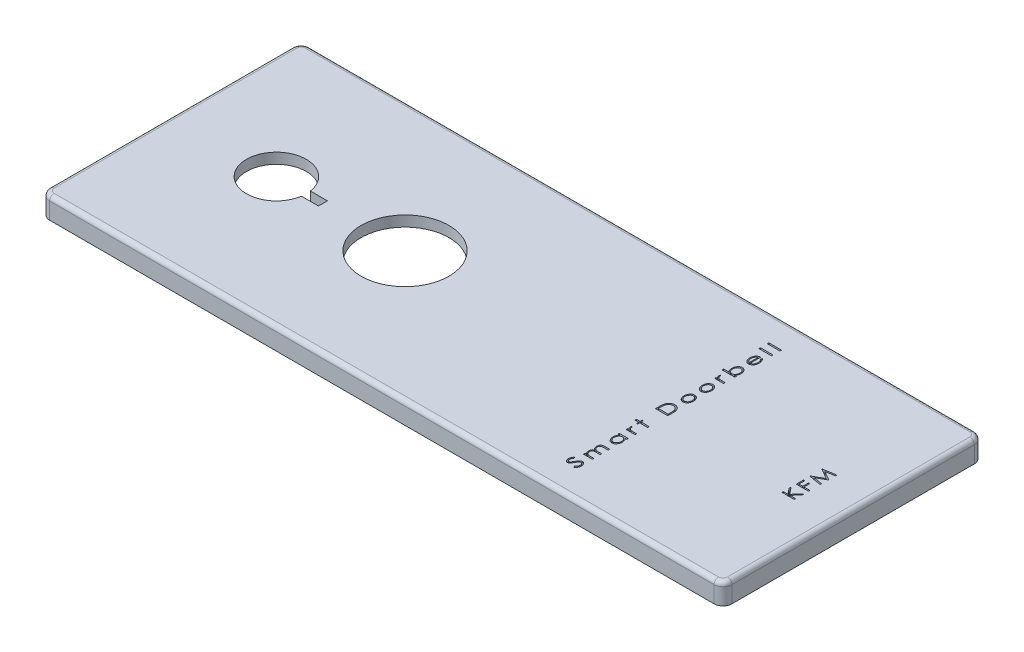
from build123d import *

# Parameters (mm, degrees)
SKETCH1_W           = 194
SKETCH1_H           = 74
BOSS_EXTRUDE1_DEPTH = 6
FILLET1_R           = 2.54
SKETCH7_W           = 192
SKETCH7_H           = 72
CUT_EXTRUDE3_DEPTH  = 3
FILLET2_R           = 2.54
FILLET3_R           = 1.27
SKETCH2_R           = 12.5
CUT_EXTRUDE4_DEPTH  = 8.385535023
SKETCH11_W          = 3.58974359
SKETCH11_H          = 0.448717949
CUT_EXTRUDE6_DEPTH  = 2.54


with BuildPart() as part:
    # Sketch1 → Boss-Extrude1 (new body)
    with BuildSketch(Plane(origin=(0, 0, 0), x_dir=(1, 0, 0), z_dir=(0, 1, 0))):
        Rectangle(SKETCH1_W, SKETCH1_H)
    extrude(amount=BOSS_EXTRUDE1_DEPTH)

    # Fillet1
    fillet1_edges = [part.edges().sort_by_distance(p)[0] for p in [
        (97, 3, 37),
        (-97, 3, 37),
        (-97, 3, -37),
        (97, 3, -37),
    ]]
    fillet(fillet1_edges, radius=FILLET1_R)

    # Sketch7 → Cut-Extrude3 (cut)
    with BuildSketch(Plane.XZ):
        Rectangle(SKETCH7_W, SKETCH7_H)
    extrude(amount=-CUT_EXTRUDE3_DEPTH, mode=Mode.SUBTRACT)

    # Fillet2
    fillet2_edges = [part.edges().sort_by_distance(p)[0] for p in [
        (96, 1.5, 36),
        (96, 1.5, -36),
        (-96, 1.5, -36),
        (-96, 1.5, 36),
    ]]
    fillet(fillet2_edges, radius=FILLET2_R)

    # Fillet3
    fillet3_edges = [part.edges().sort_by_distance(p)[0] for p in [
        (-97, 6, 0),
        (0, 6, -37),
        (97, 6, 0),
        (0, 6, 37),
        (-96.256051224, 6, 36.256051224),
        (96.256051224, 6, 36.256051224),
        (96.256051224, 6, -36.256051224),
        (-96.256051224, 6, -36.256051224),
    ]]
    fillet(fillet3_edges, radius=FILLET3_R)

    # Sketch2 → Cut-Extrude4 (cut)
    with BuildSketch(Plane(origin=(0, 6, 0), x_dir=(1, 0, 0), z_dir=(0, 1, 0))):
        with BuildLine():
            Line((-63.23174039, 1.276717301), (-63.23174039, -1.276717301))
            Line((-63.23174039, -1.276717301), (-58.596429751, -1.276717301))
            ThreePointArc((-58.596429751, -1.276717301), (-58.524141721, -0.640176883), (-58.5, 0))
            ThreePointArc((-58.5, 0), (-58.524141721, 0.640176883), (-58.596429751, 1.276717301))
            Line((-58.596429751, 1.276717301), (-63.23174039, 1.276717301))
        make_face()
        with BuildLine():
            Line((-58.596429751, -1.276717301), (-63.23174039, -1.276717301))
            Line((-63.23174039, -1.276717301), (-63.23174039, 1.276717301))
            Line((-63.23174039, 1.276717301), (-58.596429751, 1.276717301))
            ThreePointArc((-58.596429751, 1.276717301), (-75.5, 0), (-58.596429751, -1.276717301))
        make_face()
        with BuildLine():
            Line((-63.23174039, 1.276717301), (-63.23174039, -1.276717301))
            Line((-63.23174039, -1.276717301), (-58.596429751, -1.276717301))
            ThreePointArc((-58.596429751, -1.276717301), (-58.524141721, -0.640176883), (-58.5, 0))
            ThreePointArc((-58.5, 0), (-58.524141721, 0.640176883), (-58.596429751, 1.276717301))
            Line((-58.596429751, 1.276717301), (-63.23174039, 1.276717301))
        make_face()
        with BuildLine():
            Line((-58.596429751, -1.276717301), (-63.23174039, -1.276717301))
            Line((-63.23174039, -1.276717301), (-63.23174039, 1.276717301))
            Line((-63.23174039, 1.276717301), (-58.596429751, 1.276717301))
            ThreePointArc((-58.596429751, 1.276717301), (-75.5, 0), (-58.596429751, -1.276717301))
        make_face()
        with BuildLine():
            ThreePointArc((-58.5, 0), (-58.524141721, -0.640176883), (-58.596429751, -1.276717301))
            Line((-58.596429751, -1.276717301), (-53.76825961, -1.276717301))
            Line((-53.76825961, -1.276717301), (-53.76825961, 1.276717301))
            Line((-53.76825961, 1.276717301), (-58.596429751, 1.276717301))
            ThreePointArc((-58.596429751, 1.276717301), (-58.524141721, 0.640176883), (-58.5, 0))
        make_face()
        with Locations(Location((-30.415448, 0, 0), (0, 0, 270))):
            Circle(SKETCH2_R)
    extrude(amount=-CUT_EXTRUDE4_DEPTH, mode=Mode.SUBTRACT)

    # Sketch11 → Cut-Extrude6 (cut)
    # profile 1 of 16: a face of its own
    with BuildSketch(Plane(origin=(0, 6, 0), x_dir=(1, 0, 0), z_dir=(0, 1, 0))):
        with BuildLine():
            Line((46.889039679, -29.292307692), (46.711655865, -28.913701923))
            add(Edge.make_bspline(
                [(46.711655865, -28.913701923), (46.757970731, -28.879314746), (46.847732027, -28.812670104), (46.965932258, -28.701127868), (47.068029234, -28.587351678), (47.15041218, -28.468277492), (47.215601179, -28.345173689), (47.261005469, -28.217636264), (47.289947535, -28.086036475), (47.293298766, -27.996783778), (47.294989199, -27.951762821)],
                knots=[0, 0, 0, 0, 1.18159898, 2.29001761, 3.325282218, 4.310061346, 5.250817561, 6.172208976, 7.078023342, 8, 8, 8, 8], degree=3))
            add(Edge.make_bspline(
                [(47.294989199, -27.951762821), (47.294111768, -27.913384171), (47.292376334, -27.837476636), (47.27658171, -27.725648815), (47.250309192, -27.617547817), (47.215046428, -27.514200748), (47.171809079, -27.418209656), (47.12046078, -27.332844687), (47.061464308, -27.260079085), (46.995955857, -27.200210715), (46.926382167, -27.152675982), (46.853791277, -27.118544194), (46.778449705, -27.097893175), (46.727438144, -27.095027674), (46.70184016, -27.093589744)],
                knots=[0, 0, 0, 0, 1.199683564, 2.372804237, 3.523235669, 4.674224121, 5.782924596, 6.8094747, 7.780844139, 8.701655783, 9.575318352, 10.405821323, 11.200029174, 12, 12, 12, 12], degree=3))
            add(Edge.make_bspline(
                [(46.70184016, -27.093589744), (46.672617119, -27.095540588), (46.612956744, -27.099523338), (46.52496876, -27.131383383), (46.438263841, -27.182036183), (46.385840127, -27.227926858), (46.358290481, -27.252043269)],
                knots=[0, 0, 0, 0, 0.903840048, 1.845236969, 2.867631571, 4, 4, 4, 4], degree=3))
            add(Edge.make_bspline(
                [(46.358290481, -27.252043269), (46.33815545, -27.271886963), (46.295478766, -27.31394615), (46.233553917, -27.386115835), (46.168076862, -27.468997701), (46.100793949, -27.563966667), (46.028727319, -27.669125865), (45.955115224, -27.786260286), (45.877456191, -27.914051953), (45.826590309, -28.003966855), (45.800197532, -28.050620994)],
                knots=[0, 0, 0, 0, 0.693950147, 1.470844071, 2.333096396, 3.28712547, 4.328157476, 5.463343168, 6.68380505, 8, 8, 8, 8], degree=3))
            add(Edge.make_bspline(
                [(45.800197532, -28.050620994), (45.774005857, -28.097021487), (45.724012687, -28.185588092), (45.649230549, -28.31008941), (45.581707667, -28.421789649), (45.519209941, -28.519459037), (45.462619755, -28.603373611), (45.412464817, -28.674145996), (45.367136991, -28.730499324), (45.337388188, -28.762172456), (45.324135833, -28.776282051)],
                knots=[0, 0, 0, 0, 1.470410718, 2.806635812, 4.007937028, 5.072494864, 6.006298942, 6.801071501, 7.465907055, 8, 8, 8, 8], degree=3))
            add(Edge.make_bspline(
                [(45.324135833, -28.776282051), (45.303587665, -28.795721034), (45.263469406, -28.833673719), (45.200483636, -28.884662995), (45.135300598, -28.926730029), (45.069572852, -28.962489667), (45.001532577, -28.988875971), (44.932713801, -29.009116509), (44.862221406, -29.020247223), (44.814922006, -29.022133981), (44.791283269, -29.023076923)],
                knots=[0, 0, 0, 0, 1.125475438, 2.197379131, 3.218875901, 4.209072094, 5.1692903, 6.117178908, 7.059025867, 8, 8, 8, 8], degree=3))
            add(Edge.make_bspline(
                [(44.791283269, -29.023076923), (44.754183422, -29.021360854), (44.680360582, -29.017946148), (44.572761794, -28.989275862), (44.470195417, -28.943798752), (44.373879345, -28.880199304), (44.285890449, -28.799570054), (44.205537307, -28.704949164), (44.137321123, -28.594294054), (44.078726717, -28.471372551), (44.032394151, -28.338210916), (43.998418746, -28.197852505), (43.97878908, -28.051644276), (43.97592597, -27.952287499), (43.974476378, -27.901983173)],
                knots=[0, 0, 0, 0, 0.867240601, 1.725671923, 2.587703721, 3.484395499, 4.41390936, 5.372787421, 6.380585102, 7.447407238, 8.554669295, 9.67449481, 10.822596967, 12, 12, 12, 12], degree=3))
            add(Edge.make_bspline(
                [(43.974476378, -27.901983173), (43.97566231, -27.848378559), (43.9780087, -27.7423208), (44.001577703, -27.586255352), (44.03768375, -27.435379407), (44.080656444, -27.313760635), (44.123634252, -27.218212294), (44.162181835, -27.145322126), (44.207588313, -27.071810799), (44.257588048, -26.996632656), (44.315320993, -26.921481054), (44.378011171, -26.844402769), (44.447507214, -26.766734322), (44.496870138, -26.715752055), (44.5220525, -26.68974359)],
                knots=[0, 0, 0, 0, 1.407881899, 2.785521393, 4.13817915, 5.480548258, 6.167805339, 6.890410056, 7.645688891, 8.437829636, 9.262108027, 10.135064808, 11.048608351, 12, 12, 12, 12], degree=3))
            Line((44.5220525, -26.68974359), (44.737296891, -27.052924679))
            add(Edge.make_bspline(
                [(44.737296891, -27.052924679), (44.717589359, -27.074823923), (44.679365436, -27.117298799), (44.625031755, -27.180199476), (44.576941819, -27.241424543), (44.532945058, -27.29935906), (44.495389859, -27.355655164), (44.461866313, -27.408777411), (44.434708125, -27.460076347), (44.404403105, -27.524705147), (44.376034259, -27.606560301), (44.351189294, -27.707689446), (44.336182451, -27.813192245), (44.334370525, -27.885108006), (44.333450737, -27.921614583)],
                knots=[0, 0, 0, 0, 1.076597331, 2.088124094, 3.036423676, 3.921181853, 4.745469441, 5.508604631, 6.215425407, 6.864980066, 8.115604893, 9.372889374, 10.666400572, 12, 12, 12, 12], degree=3))
            add(Edge.make_bspline(
                [(44.333450737, -27.921614583), (44.334627058, -27.967559044), (44.336884536, -28.055731103), (44.362409156, -28.180935213), (44.400954829, -28.294015599), (44.448428073, -28.376898296), (44.492725451, -28.434633623), (44.527576513, -28.471963889), (44.564723667, -28.503158019), (44.603063658, -28.52968767), (44.644323141, -28.548949552), (44.686595406, -28.564352852), (44.7311266, -28.572704884), (44.761338186, -28.573804802), (44.776559712, -28.574358974)],
                knots=[0, 0, 0, 0, 1.888920497, 3.625029172, 5.238005106, 6.78953948, 7.530511953, 8.231613766, 8.887054938, 9.524884661, 10.144602648, 10.756275426, 11.373373346, 12, 12, 12, 12], degree=3))
            add(Edge.make_bspline(
                [(44.776559712, -28.574358974), (44.795296698, -28.573397356), (44.83308822, -28.571457823), (44.88927289, -28.560435771), (44.944078664, -28.539826239), (44.999212702, -28.51228669), (45.055029191, -28.473277817), (45.111224907, -28.421289813), (45.170706898, -28.357681676), (45.20860942, -28.309198759), (45.228783269, -28.283393429)],
                knots=[0, 0, 0, 0, 0.80510108, 1.62384681, 2.446090813, 3.312295497, 4.264354022, 5.358646259, 6.59412333, 8, 8, 8, 8], degree=3))
            add(Edge.make_bspline(
                [(45.228783269, -28.283393429), (45.235637563, -28.273629045), (45.252029616, -28.250277505), (45.278351009, -28.207966507), (45.31129233, -28.15275975), (45.352163817, -28.085143969), (45.398567421, -28.003943016), (45.452214885, -27.910300593), (45.51245845, -27.803698198), (45.55482909, -27.728118487), (45.577240801, -27.688141026)],
                knots=[0, 0, 0, 0, 0.414939005, 0.992327248, 1.732675797, 2.651488209, 3.740549015, 4.985896868, 6.40570715, 8, 8, 8, 8], degree=3))
            add(Edge.make_bspline(
                [(45.577240801, -27.688141026), (45.604821727, -27.640095454), (45.658045979, -27.547379581), (45.738879109, -27.415255061), (45.817029782, -27.294563504), (45.893452378, -27.185945085), (45.966899508, -27.088751612), (46.038252597, -27.003536638), (46.107839007, -26.930543721), (46.174743084, -26.867556088), (46.241934337, -26.815494031), (46.307371506, -26.769342984), (46.374040732, -26.731413885), (46.440120726, -26.699570199), (46.506959953, -26.6755952), (46.573294083, -26.658011866), (46.64000213, -26.646876874), (46.68450389, -26.645540019), (46.706748013, -26.644871795)],
                knots=[0, 0, 0, 0, 1.654080378, 3.191959259, 4.624239409, 5.946527435, 7.156573893, 8.260914573, 9.262885886, 10.166527317, 11.001347069, 11.798847207, 12.555328937, 13.288868751, 13.986408186, 14.671906212, 15.336154766, 16, 16, 16, 16], degree=3))
            add(Edge.make_bspline(
                [(46.706748013, -26.644871795), (46.738144783, -26.645888033), (46.800504095, -26.647906455), (46.892290599, -26.666018339), (46.980669992, -26.695945383), (47.066169556, -26.736721118), (47.148038171, -26.790165807), (47.226616103, -26.855005996), (47.301972243, -26.931563721), (47.373346234, -27.018337284), (47.438640282, -27.11368293), (47.496251538, -27.215019409), (47.5458205, -27.320968189), (47.584917987, -27.432703334), (47.615721849, -27.549239885), (47.638157195, -27.67084583), (47.651792144, -27.79743614), (47.653231805, -27.883486046), (47.653963558, -27.927223558)],
                knots=[0, 0, 0, 0, 0.855215978, 1.698603995, 2.538713148, 3.393573107, 4.273606149, 5.197008056, 6.165568152, 7.197451656, 8.255955132, 9.311674963, 10.372017383, 11.439968988, 12.534052632, 13.654908543, 14.808035136, 16, 16, 16, 16], degree=3))
            add(Edge.make_bspline(
                [(47.653963558, -27.927223558), (47.653455635, -27.961131909), (47.652448716, -28.028352747), (47.643482538, -28.12777304), (47.630767475, -28.225090545), (47.61055056, -28.319720443), (47.586442352, -28.41237586), (47.555998197, -28.502471597), (47.52036061, -28.590135599), (47.478746724, -28.675436725), (47.43089524, -28.758870561), (47.375140593, -28.840092922), (47.312766709, -28.920060999), (47.242913278, -28.998467346), (47.164851717, -29.07444688), (47.080081883, -29.149519312), (46.9878755, -29.22279798), (46.922467644, -29.268798319), (46.889039679, -29.292307692)],
                knots=[0, 0, 0, 0, 0.993936135, 1.970406054, 2.924919642, 3.869643596, 4.80537901, 5.73061892, 6.655681204, 7.578100447, 8.511298525, 9.472966899, 10.463969947, 11.483118484, 12.549103058, 13.65588568, 14.801994522, 16, 16, 16, 16], degree=3))
        make_face()
    # profile 2 of 16: a face of its own
    with BuildSketch(Plane(origin=(0, 6, 0), x_dir=(1, 0, 0), z_dir=(0, 1, 0))):
        with BuildLine():
            Line((45.00652766, -24.706410256), (45.00652766, -24.257692308))
            Line((45.00652766, -24.257692308), (45.451038878, -24.257692308))
            add(Edge.make_bspline(
                [(45.451038878, -24.257692308), (45.41205999, -24.221174176), (45.336801783, -24.150667059), (45.237985432, -24.037750196), (45.155446463, -23.923587715), (45.112297715, -23.843583146), (45.091363397, -23.804767628)],
                knots=[0, 0, 0, 0, 1.101334499, 2.126393606, 3.090989394, 4, 4, 4, 4], degree=3))
            add(Edge.make_bspline(
                [(45.091363397, -23.804767628), (45.071300416, -23.751140539), (45.03116006, -23.643847892), (44.991326107, -23.476325512), (44.96671732, -23.304903744), (44.963351911, -23.189266583), (44.961655865, -23.130989583)],
                knots=[0, 0, 0, 0, 0.994664579, 1.990042673, 2.987053289, 4, 4, 4, 4], degree=3))
            add(Edge.make_bspline(
                [(44.961655865, -23.130989583), (44.962714803, -23.091694715), (44.964813478, -23.013817475), (44.978047234, -22.898552483), (45.001484482, -22.786521975), (45.033406018, -22.678644479), (45.073042258, -22.577200018), (45.118327253, -22.483882161), (45.170444358, -22.400802396), (45.228919718, -22.325808429), (45.297877737, -22.258159538), (45.380144957, -22.198069024), (45.47389712, -22.140136128), (45.543185877, -22.108458192), (45.579344167, -22.091927083)],
                knots=[0, 0, 0, 0, 1.097831083, 2.17575623, 3.235997344, 4.291624794, 5.314936543, 6.275593864, 7.184984423, 8.049682257, 8.926909759, 9.873621098, 10.890350652, 12, 12, 12, 12], degree=3))
            add(Edge.make_bspline(
                [(45.579344167, -22.091927083), (45.554577858, -22.073993699), (45.505617117, -22.038541026), (45.43664701, -21.980562005), (45.37220791, -21.919750176), (45.31225089, -21.855590949), (45.256799754, -21.788121389), (45.205427317, -21.717373731), (45.159313647, -21.642960962), (45.1177108, -21.56574553), (45.081795678, -21.485784824), (45.048954668, -21.404702232), (45.022850891, -21.321489091), (44.999652374, -21.237281548), (44.983625031, -21.151101128), (44.970281475, -21.06373315), (44.963664153, -20.974673999), (44.962328192, -20.914751552), (44.961655865, -20.884595353)],
                knots=[0, 0, 0, 0, 1.039298392, 2.054598512, 3.060685051, 4.050098551, 5.037947508, 6.028126413, 7.020279882, 8.012083312, 9.00766699, 9.999183933, 10.984184812, 11.970978698, 12.966720897, 13.962304575, 14.97452203, 16, 16, 16, 16], degree=3))
            add(Edge.make_bspline(
                [(44.961655865, -20.884595353), (44.963271226, -20.829585699), (44.966429427, -20.722036058), (44.99104618, -20.565878318), (45.032687608, -20.419659105), (45.081226263, -20.305926292), (45.128253563, -20.221601901), (45.166045065, -20.162306513), (45.207552967, -20.107461692), (45.252501752, -20.056752067), (45.301014063, -20.010576849), (45.352353979, -19.968082446), (45.40720067, -19.930433676), (45.465400745, -19.895907964), (45.529575888, -19.866328306), (45.600555894, -19.840313145), (45.679273496, -19.819111898), (45.764879967, -19.800753518), (45.857849997, -19.786918346), (45.958241487, -19.777249468), (46.066096397, -19.771827521), (46.140469357, -19.770959977), (46.178803301, -19.770512821)],
                knots=[0, 0, 0, 0, 1.740115549, 3.40210833, 4.986751564, 6.540393993, 7.301767359, 8.040242504, 8.763490493, 9.475882005, 10.181989344, 10.880778504, 11.582340415, 12.284992797, 13.019458093, 13.814905421, 14.674298876, 15.596763126, 16.584059029, 17.646615918, 18.786998757, 20, 20, 20, 20], degree=3))
            Line((46.178803301, -19.770512821), (47.564219968, -19.770512821))
            Line((47.564219968, -19.770512821), (47.564219968, -20.219230769))
            Line((47.564219968, -20.219230769), (46.177401058, -20.219230769))
            add(Edge.make_bspline(
                [(46.177401058, -20.219230769), (46.144678763, -20.219532791), (46.081785649, -20.220113285), (45.991537147, -20.223578494), (45.909224781, -20.229112937), (45.834796446, -20.236562592), (45.768197947, -20.246632934), (45.709888166, -20.260412607), (45.659016615, -20.274207088), (45.602700644, -20.298012675), (45.539973478, -20.335166087), (45.474389353, -20.393806498), (45.416362691, -20.465225267), (45.366263993, -20.548470847), (45.325621211, -20.642759172), (45.296384379, -20.746439995), (45.278521833, -20.858970783), (45.276700039, -20.936876954), (45.275758429, -20.977143429)],
                knots=[0, 0, 0, 0, 1.143098113, 2.197064715, 3.154501, 4.02454852, 4.809751659, 5.504904279, 6.117215791, 6.647885767, 7.636389118, 8.648645385, 9.70444437, 10.839966305, 12.032044546, 13.280199171, 14.594247509, 16, 16, 16, 16], degree=3))
            add(Edge.make_bspline(
                [(45.275758429, -20.977143429), (45.277586792, -21.026561804), (45.281191282, -21.123986731), (45.307529599, -21.267031109), (45.352409397, -21.403139209), (45.402667386, -21.51090796), (45.451729317, -21.591207025), (45.490372745, -21.648378524), (45.533927584, -21.699915237), (45.578224796, -21.749059523), (45.6273629, -21.792228658), (45.678085205, -21.832628513), (45.732782712, -21.867441094), (45.790261221, -21.900051866), (45.854744823, -21.927943292), (45.928316579, -21.950329758), (46.011259395, -21.971071571), (46.104174925, -21.986380598), (46.206610871, -21.999081842), (46.318651148, -22.008141197), (46.440752655, -22.012604891), (46.525388176, -22.013590742), (46.569328141, -22.014102564)],
                knots=[0, 0, 0, 0, 1.557483399, 3.070471446, 4.566230727, 6.065741215, 6.806162569, 7.531661784, 8.238209249, 8.931573699, 9.615003145, 10.297359546, 10.973763715, 11.656438231, 12.379088812, 13.182953495, 14.078184211, 15.072601343, 16.149083951, 17.331763349, 18.614739708, 20, 20, 20, 20], degree=3))
            Line((46.569328141, -22.014102564), (47.564219968, -22.014102564))
            Line((47.564219968, -22.014102564), (47.564219968, -22.462820513))
            Line((47.564219968, -22.462820513), (46.263639038, -22.462820513))
            add(Edge.make_bspline(
                [(46.263639038, -22.462820513), (46.226949153, -22.463243987), (46.156363562, -22.464058684), (46.05506012, -22.465927513), (45.963033431, -22.473026636), (45.880105048, -22.479840594), (45.80679052, -22.490836043), (45.742070595, -22.501867711), (45.68716116, -22.517427402), (45.625620219, -22.539467787), (45.558884996, -22.577296146), (45.487422726, -22.634799047), (45.425603868, -22.707133066), (45.371670627, -22.791162959), (45.328545194, -22.886337297), (45.297441193, -22.991014661), (45.279357928, -23.104185708), (45.276979891, -23.182573311), (45.275758429, -23.222836538)],
                knots=[0, 0, 0, 0, 1.211694182, 2.3311097, 3.344442162, 4.25901649, 5.077546103, 5.791957782, 6.424812874, 6.95952987, 7.947448357, 8.940567637, 9.97435178, 11.074664523, 12.228117035, 13.412269116, 14.670830671, 16, 16, 16, 16], degree=3))
            add(Edge.make_bspline(
                [(45.275758429, -23.222836538), (45.27728506, -23.270402137), (45.280316477, -23.364852703), (45.307431564, -23.503805076), (45.350302394, -23.638048525), (45.409600736, -23.765518872), (45.482783787, -23.882820054), (45.56990753, -23.984990497), (45.668503455, -24.07095095), (45.760687848, -24.129649757), (45.842988459, -24.166847916), (45.91272729, -24.191148053), (45.989985024, -24.212260635), (46.074907481, -24.228528302), (46.167270471, -24.242153407), (46.267250473, -24.250678576), (46.375049215, -24.256478389), (46.449427689, -24.257277773), (46.487998013, -24.257692308)],
                knots=[0, 0, 0, 0, 1.253865983, 2.489789985, 3.72021086, 4.964351554, 6.189182499, 7.356887196, 8.493190418, 9.629125542, 10.225149921, 10.872600471, 11.575623069, 12.336233242, 13.152419818, 14.037781816, 14.9824557, 16, 16, 16, 16], degree=3))
            Line((46.487998013, -24.257692308), (47.564219968, -24.257692308))
            Line((47.564219968, -24.257692308), (47.564219968, -24.706410256))
            Line((47.564219968, -24.706410256), (45.00652766, -24.706410256))
        make_face()
    # profile 3 of 16: a face of its own
    with BuildSketch(Plane(origin=(0, 6, 0), x_dir=(1, 0, 0), z_dir=(0, 1, 0))):
        with BuildLine():
            Line((45.00652766, -14.466666667), (47.564219968, -14.466666667))
            Line((47.564219968, -14.466666667), (47.564219968, -14.915384615))
            Line((47.564219968, -14.915384615), (47.121812115, -14.915384615))
            add(Edge.make_bspline(
                [(47.121812115, -14.915384615), (47.162021673, -14.960177081), (47.241713462, -15.04895179), (47.343735067, -15.194791613), (47.427299609, -15.349535615), (47.495083458, -15.511574453), (47.546254598, -15.681830134), (47.582074756, -15.859544226), (47.605682666, -16.044960149), (47.607941122, -16.171253069), (47.609091763, -16.235596955)],
                knots=[0, 0, 0, 0, 1.000141611, 1.982192266, 2.950680942, 3.919122848, 4.897600045, 5.90123798, 6.930719926, 8, 8, 8, 8], degree=3))
            add(Edge.make_bspline(
                [(47.609091763, -16.235596955), (47.607858359, -16.292670093), (47.605425588, -16.405241369), (47.586827033, -16.570749663), (47.55676804, -16.729943231), (47.514843704, -16.882808382), (47.459831798, -17.029085155), (47.393014278, -17.1691412), (47.314229204, -17.303060884), (47.223822684, -17.428600574), (47.125313576, -17.543583659), (47.020521197, -17.644837118), (46.909904367, -17.730436825), (46.793641828, -17.80031206), (46.672212629, -17.854874519), (46.545535146, -17.893606434), (46.413646322, -17.917492123), (46.323801876, -17.920349659), (46.278362596, -17.921794872)],
                knots=[0, 0, 0, 0, 1.149825968, 2.267921147, 3.351292848, 4.411532189, 5.457652975, 6.496092779, 7.534724766, 8.584157928, 9.609304174, 10.581842155, 11.515285724, 12.421436469, 13.308880013, 14.190720771, 15.08494796, 16, 16, 16, 16], degree=3))
            add(Edge.make_bspline(
                [(46.278362596, -17.921794872), (46.233863269, -17.920319306), (46.145655458, -17.917394399), (46.015930386, -17.893807049), (45.891299794, -17.853915033), (45.771552129, -17.799076704), (45.657136394, -17.728089057), (45.548043489, -17.641533934), (45.443038982, -17.540276433), (45.345778514, -17.423647431), (45.255579452, -17.297177142), (45.17727752, -17.162219216), (45.109953239, -17.021545824), (45.056175301, -16.873900966), (45.013161188, -16.720468354), (44.983049646, -16.560259249), (44.965548462, -16.393975534), (44.962965596, -16.28097745), (44.961655865, -16.223677885)],
                knots=[0, 0, 0, 0, 0.897261844, 1.778577538, 2.649325713, 3.531133061, 4.428679736, 5.358639195, 6.335549813, 7.365975323, 8.417697389, 9.465640286, 10.50951357, 11.559596491, 12.631383867, 13.72061521, 14.844159534, 16, 16, 16, 16], degree=3))
            add(Edge.make_bspline(
                [(44.961655865, -16.223677885), (44.963094824, -16.157708794), (44.965910584, -16.028620178), (44.989177679, -15.839807244), (45.028936079, -15.66097459), (45.073266738, -15.518356755), (45.118710614, -15.41013052), (45.156450897, -15.331642254), (45.198496007, -15.255580232), (45.245821824, -15.182451356), (45.297565136, -15.111747214), (45.354068746, -15.043697656), (45.414048788, -14.977297129), (45.45775864, -14.936129681), (45.479784872, -14.915384615)],
                knots=[0, 0, 0, 0, 1.63656381, 3.202435487, 4.710757276, 6.177917683, 6.900563395, 7.621601854, 8.338055115, 9.055469948, 9.781551101, 10.510682641, 11.249504442, 12, 12, 12, 12], degree=3))
            Line((45.479784872, -14.915384615), (45.00652766, -14.915384615))
            Line((45.00652766, -14.915384615), (45.00652766, -14.466666667))
        make_face()
        with BuildLine():
            add(Edge.make_bspline(
                [(45.275758429, -16.192828526), (45.277391697, -16.249472651), (45.280613181, -16.361198497), (45.305691306, -16.525569961), (45.347183702, -16.683212486), (45.404108777, -16.833101632), (45.476928722, -16.971522274), (45.562633101, -17.0973568), (45.66318969, -17.207172872), (45.756720626, -17.286860126), (45.836811145, -17.340693524), (45.897672643, -17.376103511), (45.959191686, -17.406745383), (46.022458725, -17.430063353), (46.08607522, -17.449349006), (46.150449475, -17.463666113), (46.216013813, -17.471232304), (46.259882719, -17.472461097), (46.281868205, -17.473076923)],
                knots=[0, 0, 0, 0, 1.507968544, 2.974343044, 4.415983075, 5.842267035, 7.234190907, 8.572097274, 9.88497308, 11.187853633, 11.833433198, 12.452551272, 13.06211745, 13.660880941, 14.245670215, 14.831617455, 15.414449519, 16, 16, 16, 16], degree=3))
            add(Edge.make_bspline(
                [(46.281868205, -17.473076923), (46.303631267, -17.472542557), (46.347317544, -17.471469892), (46.412225927, -17.462614173), (46.476742652, -17.449336324), (46.540360731, -17.43047859), (46.603146782, -17.405684065), (46.66513931, -17.375216055), (46.726501559, -17.339588688), (46.807401508, -17.285131996), (46.901956403, -17.205115675), (47.003819061, -17.094556476), (47.091178065, -16.968276721), (47.164100014, -16.828884232), (47.223066977, -16.67974563), (47.263955086, -16.522896344), (47.290331651, -16.36105445), (47.2934268, -16.251124508), (47.294989199, -16.195633013)],
                knots=[0, 0, 0, 0, 0.579533339, 1.163331439, 1.742095122, 2.333053014, 2.92845426, 3.538231715, 4.171458662, 4.817261987, 6.134129643, 7.460455727, 8.811035068, 10.2118506, 11.643131428, 13.073233751, 14.522598713, 16, 16, 16, 16], degree=3))
            add(Edge.make_bspline(
                [(47.294989199, -16.195633013), (47.293331597, -16.139458262), (47.290048716, -16.02820414), (47.264992492, -15.863555758), (47.222561784, -15.703695751), (47.17387069, -15.57505816), (47.128774881, -15.475949768), (47.090318994, -15.40635105), (47.050111442, -15.340485337), (47.006578066, -15.279296638), (46.960008652, -15.223001866), (46.910864791, -15.170695864), (46.858140302, -15.123137654), (46.802945266, -15.079660288), (46.745281674, -15.040997821), (46.685846115, -15.007265996), (46.624330966, -14.97904137), (46.561218088, -14.956032706), (46.496415668, -14.937383628), (46.429471777, -14.925090644), (46.36081958, -14.917109726), (46.314375829, -14.915962471), (46.290982788, -14.915384615)],
                knots=[0, 0, 0, 0, 1.862929283, 3.689532413, 5.509790606, 7.339943861, 8.245264366, 9.119513625, 9.975807529, 10.80402206, 11.608044803, 12.39773713, 13.182581747, 13.961121671, 14.726582501, 15.483357194, 16.225699007, 16.968850001, 17.710016933, 18.459609924, 19.224127972, 20, 20, 20, 20], degree=3))
            add(Edge.make_bspline(
                [(46.290982788, -14.915384615), (46.255612297, -14.916357025), (46.185823899, -14.918275655), (46.083536795, -14.936695239), (45.985378725, -14.965028262), (45.892138127, -15.006423394), (45.803296494, -15.058718242), (45.718578515, -15.122132338), (45.639080089, -15.198057687), (45.56504069, -15.284289883), (45.497361901, -15.378664136), (45.437299784, -15.478948897), (45.38761263, -15.58532655), (45.347093048, -15.696641608), (45.314087211, -15.812943436), (45.292641087, -15.935137051), (45.27765, -16.062281412), (45.276395722, -16.148845616), (45.275758429, -16.192828526)],
                knots=[0, 0, 0, 0, 0.934434866, 1.843703859, 2.739261944, 3.630245698, 4.533235222, 5.460181769, 6.421866164, 7.43398917, 8.461260833, 9.48927571, 10.520406241, 11.560497361, 12.619021795, 13.71231236, 14.837635478, 16, 16, 16, 16], degree=3))
        make_face(mode=Mode.SUBTRACT)
    # profile 4 of 16: a face of its own
    with BuildSketch(Plane(origin=(0, 6, 0), x_dir=(1, 0, 0), z_dir=(0, 1, 0))):
        with BuildLine():
            Line((45.00652766, -12.573076923), (45.00652766, -12.124358974))
            Line((45.00652766, -12.124358974), (45.383030064, -12.124358974))
            add(Edge.make_bspline(
                [(45.383030064, -12.124358974), (45.347814098, -12.092751154), (45.279689956, -12.031606853), (45.190764337, -11.932068351), (45.11693833, -11.830092939), (45.058870653, -11.724675014), (45.015454466, -11.616860224), (44.98411806, -11.507170262), (44.965459385, -11.395130909), (44.962926676, -11.319539367), (44.961655865, -11.281610577)],
                knots=[0, 0, 0, 0, 1.165028545, 2.253709828, 3.281048339, 4.260215642, 5.210661489, 6.138304608, 7.065876261, 8, 8, 8, 8], degree=3))
            add(Edge.make_bspline(
                [(44.961655865, -11.281610577), (44.962853164, -11.252331158), (44.965312408, -11.192191374), (44.982190822, -11.100938393), (45.009697968, -11.006716642), (45.035795104, -10.944834413), (45.04929609, -10.912820513)],
                knots=[0, 0, 0, 0, 0.920268616, 1.890227253, 2.908538786, 4, 4, 4, 4], degree=3))
            Line((45.04929609, -10.912820513), (45.321331346, -11.133673878))
            add(Edge.make_bspline(
                [(45.321331346, -11.133673878), (45.314579113, -11.15441026), (45.301700962, -11.193959582), (45.286571359, -11.251379681), (45.277713001, -11.304002922), (45.276382569, -11.337439193), (45.275758429, -11.353125)],
                knots=[0, 0, 0, 0, 1.162551218, 2.217267876, 3.163674949, 4, 4, 4, 4], degree=3))
            add(Edge.make_bspline(
                [(45.275758429, -11.353125), (45.277359883, -11.387641232), (45.280573027, -11.456894341), (45.307478935, -11.558963941), (45.349216462, -11.659301139), (45.39823277, -11.739152305), (45.444624794, -11.801328556), (45.48610474, -11.844870475), (45.531252344, -11.886302258), (45.581768674, -11.923956102), (45.635666553, -11.960450443), (45.69553637, -11.992024524), (45.759331793, -12.021790461), (45.804049105, -12.038645219), (45.82684016, -12.047235577)],
                knots=[0, 0, 0, 0, 1.310358642, 2.62909372, 3.987049435, 5.429972903, 6.178062671, 6.932352039, 7.712263136, 8.504774094, 9.325324213, 10.183996177, 11.074438036, 12, 12, 12, 12], degree=3))
            add(Edge.make_bspline(
                [(45.82684016, -12.047235577), (45.84707049, -12.053707388), (45.891856956, -12.068034863), (45.967488328, -12.081945052), (46.056483204, -12.095802997), (46.159326123, -12.105239996), (46.276105763, -12.115145567), (46.406640682, -12.119801996), (46.551076203, -12.123557575), (46.651823229, -12.124083325), (46.704644647, -12.124358974)],
                knots=[0, 0, 0, 0, 0.57608303, 1.275348597, 2.083779017, 3.021246915, 4.07763995, 5.265125727, 6.566112112, 8, 8, 8, 8], degree=3))
            Line((46.704644647, -12.124358974), (47.564219968, -12.124358974))
            Line((47.564219968, -12.124358974), (47.564219968, -12.573076923))
            Line((47.564219968, -12.573076923), (45.00652766, -12.573076923))
        make_face()
    # profile 5 of 16: a face of its own
    with BuildSketch(Plane(origin=(0, 6, 0), x_dir=(1, 0, 0), z_dir=(0, 1, 0))):
        Polygon((43.974476378, -9.019230769), (43.974476378, -8.570512821), (45.00652766, -8.570512821), (45.00652766, -7.987179487), (45.320630224, -7.987179487), (45.320630224, -8.570512821), (47.564219968, -8.570512821), (47.564219968, -9.019230769), (45.320630224, -9.019230769), (45.320630224, -9.602564103), (45.00652766, -9.602564103), (45.00652766, -9.019230769), align=None)
    # profile 6 of 16: a face of its own
    with BuildSketch(Plane(origin=(0, 6, 0), x_dir=(1, 0, 0), z_dir=(0, 1, 0))):
        with BuildLine():
            Line((47.564219968, -3.257692308), (44.064219968, -3.257692308))
            Line((44.064219968, -3.257692308), (44.064219968, -2.340625))
            add(Edge.make_bspline(
                [(44.064219968, -2.340625), (44.064661924, -2.260927648), (44.065516142, -2.106887789), (44.070947705, -1.884344905), (44.080452627, -1.678834341), (44.09461999, -1.490432361), (44.111517409, -1.318940792), (44.133165345, -1.164324128), (44.158357763, -1.026591553), (44.180166493, -0.941320195), (44.190421891, -0.901221955)],
                knots=[0, 0, 0, 0, 1.320378414, 2.552040963, 3.687810066, 4.728372154, 5.681920315, 6.542159468, 7.314461027, 8, 8, 8, 8], degree=3))
            add(Edge.make_bspline(
                [(44.190421891, -0.901221955), (44.205828491, -0.848869613), (44.236152122, -0.745828513), (44.293251585, -0.597768992), (44.358582176, -0.4583461), (44.431898758, -0.327824399), (44.514111824, -0.206628326), (44.602799236, -0.092938847), (44.701438077, 0.010702019), (44.807302494, 0.105595406), (44.91994732, 0.190198329), (45.038235632, 0.264427156), (45.16203008, 0.326788823), (45.290864101, 0.378605308), (45.425620494, 0.417447178), (45.565232735, 0.446476168), (45.710265355, 0.463492884), (45.808566994, 0.465599128), (45.858390641, 0.466666667)],
                knots=[0, 0, 0, 0, 1.122565209, 2.209459032, 3.2614397, 4.288593731, 5.286269227, 6.272403775, 7.252115153, 8.226168543, 9.194698046, 10.14742285, 11.095865833, 12.04334518, 13.000525955, 13.977613638, 14.974964559, 16, 16, 16, 16], degree=3))
            add(Edge.make_bspline(
                [(45.858390641, 0.466666667), (45.901668703, 0.466008285), (45.987059642, 0.464709247), (46.112855708, 0.449911656), (46.234667568, 0.427520653), (46.352884781, 0.39708429), (46.46692435, 0.355939171), (46.577006794, 0.306062274), (46.683462112, 0.247855281), (46.784646272, 0.180239442), (46.88115583, 0.106483809), (46.97092957, 0.026118972), (47.054853036, -0.058851509), (47.132102969, -0.149589036), (47.202972726, -0.245573478), (47.266961849, -0.347143406), (47.324708817, -0.453798672), (47.37542781, -0.567337333), (47.420959291, -0.688872887), (47.458935772, -0.8212335), (47.492100285, -0.964630988), (47.518159942, -1.11992865), (47.539242111, -1.286449293), (47.553455175, -1.46449311), (47.562947636, -1.653889114), (47.563787462, -1.784155432), (47.564219968, -1.851241987)],
                knots=[0, 0, 0, 0, 0.956811714, 1.887862953, 2.797310886, 3.695033437, 4.584502817, 5.475203048, 6.365903279, 7.264830517, 8.164337215, 9.050375243, 9.927654356, 10.804003977, 11.683837923, 12.564385286, 13.457153118, 14.364114909, 15.3127791, 16.325329632, 17.407479544, 18.566645702, 19.806659421, 21.118973919, 22.516284823, 24, 24, 24, 24], degree=3))
            Line((47.564219968, -1.851241987), (47.564219968, -3.257692308))
        make_face()
        with BuildLine():
            Line((47.205245609, -2.808974359), (47.205245609, -2.302764423))
            add(Edge.make_bspline(
                [(47.205245609, -2.302764423), (47.205001174, -2.2298456), (47.204532629, -2.090071189), (47.20032326, -1.889054525), (47.193479508, -1.705558914), (47.183969861, -1.539326143), (47.171191231, -1.390439035), (47.157214188, -1.258888692), (47.139495566, -1.14459617), (47.123569965, -1.075028838), (47.116203141, -1.042848558)],
                knots=[0, 0, 0, 0, 1.382929248, 2.650867278, 3.812994955, 4.865298906, 5.808343215, 6.64681211, 7.374045771, 8, 8, 8, 8], degree=3))
            add(Edge.make_bspline(
                [(47.116203141, -1.042848558), (47.105006192, -1.002503446), (47.083053015, -0.923401242), (47.042315733, -0.809098201), (46.994479428, -0.702020511), (46.941266476, -0.600865884), (46.880698242, -0.506781403), (46.814083974, -0.419155554), (46.741728602, -0.337652904), (46.662175528, -0.264566455), (46.578476897, -0.197483941), (46.488963993, -0.139716286), (46.394572785, -0.09144682), (46.296187267, -0.051098754), (46.193021816, -0.020327513), (46.085419609, 0.0021746), (45.973023346, 0.015758509), (45.896522534, 0.017211273), (45.857689519, 0.017948718)],
                knots=[0, 0, 0, 0, 1.124968063, 2.205656428, 3.257208366, 4.274285025, 5.274289752, 6.260352158, 7.229956177, 8.198746223, 9.159994866, 10.10943492, 11.056045662, 12.005402621, 12.963095144, 13.944807681, 14.956752073, 16, 16, 16, 16], degree=3))
            add(Edge.make_bspline(
                [(45.857689519, 0.017948718), (45.816758463, 0.01694709), (45.736287747, 0.014977884), (45.617865219, 0.001191562), (45.504641699, -0.024117711), (45.395077744, -0.056435177), (45.290647616, -0.100404525), (45.190330834, -0.15320791), (45.094697332, -0.21577939), (45.004419666, -0.288201149), (44.919791904, -0.368680453), (44.841423151, -0.456677529), (44.770618489, -0.552713485), (44.705690554, -0.655719774), (44.649231063, -0.767349607), (44.598549501, -0.885661481), (44.555712124, -1.011913963), (44.532959726, -1.099250639), (44.521351378, -1.143810096)],
                knots=[0, 0, 0, 0, 1.020887565, 2.007071377, 2.967456955, 3.9115721, 4.852280211, 5.788353728, 6.735756073, 7.697979576, 8.671018075, 9.645452313, 10.632892859, 11.643729753, 12.678681865, 13.749454895, 14.851764538, 16, 16, 16, 16], degree=3))
            add(Edge.make_bspline(
                [(44.521351378, -1.143810096), (44.513208696, -1.180655129), (44.495726708, -1.259759836), (44.477294586, -1.387990484), (44.460487335, -1.532468692), (44.44646128, -1.693549938), (44.436422275, -1.871258771), (44.42882446, -2.065733008), (44.423724874, -2.276795926), (44.423375625, -2.423120485), (44.423194327, -2.499078526)],
                knots=[0, 0, 0, 0, 0.6650736, 1.427884516, 2.282430933, 3.229597485, 4.278006003, 5.420260232, 6.66084014, 8, 8, 8, 8], degree=3))
            Line((44.423194327, -2.499078526), (44.423194327, -2.808974359))
            Line((44.423194327, -2.808974359), (47.205245609, -2.808974359))
        make_face(mode=Mode.SUBTRACT)
    # profile 7 of 16: a face of its own
    with BuildSketch(Plane(origin=(0, 6, 0), x_dir=(1, 0, 0), z_dir=(0, 1, 0))):
        with BuildLine():
            add(Edge.make_bspline(
                [(44.961655865, 3.977043269), (44.962689312, 4.03880293), (44.964715165, 4.159869619), (44.985857326, 4.337080335), (45.018795967, 4.506308481), (45.06360272, 4.667959719), (45.124055627, 4.820863071), (45.196235639, 4.965915038), (45.281842897, 5.103181107), (45.349210878, 5.187112608), (45.383030064, 5.229246795)],
                knots=[0, 0, 0, 0, 1.097812022, 2.152027136, 3.168404786, 4.161715094, 5.13027777, 6.087458756, 7.039891229, 8, 8, 8, 8], degree=3))
            add(Edge.make_bspline(
                [(45.383030064, 5.229246795), (45.41505513, 5.265212114), (45.477703346, 5.335568351), (45.581210168, 5.427328131), (45.688708885, 5.505387299), (45.800438043, 5.57006116), (45.917611269, 5.618817797), (46.038405558, 5.655391279), (46.16402017, 5.676771187), (46.249303634, 5.67942742), (46.292385032, 5.680769231)],
                knots=[0, 0, 0, 0, 1.100397171, 2.152623868, 3.155292484, 4.134298437, 5.097038208, 6.050627981, 7.015264311, 8, 8, 8, 8], degree=3))
            add(Edge.make_bspline(
                [(46.292385032, 5.680769231), (46.335718573, 5.679268562), (46.421569871, 5.676295477), (46.548010865, 5.653046981), (46.670298813, 5.615559839), (46.788799094, 5.56367943), (46.902269232, 5.495116317), (47.012010083, 5.412971413), (47.116929098, 5.314939423), (47.21674429, 5.203849052), (47.30907404, 5.081414632), (47.389354124, 4.948573435), (47.457408557, 4.807481385), (47.512960797, 4.65765587), (47.556464977, 4.499568247), (47.58703465, 4.332781962), (47.605475417, 4.157647949), (47.607869463, 4.038086411), (47.609091763, 3.977043269)],
                knots=[0, 0, 0, 0, 0.870154496, 1.723927757, 2.573468785, 3.435401244, 4.31551868, 5.231091511, 6.184642541, 7.19533158, 8.228285543, 9.260599047, 10.308491124, 11.370748216, 12.466552481, 13.59834036, 14.773812624, 16, 16, 16, 16], degree=3))
            add(Edge.make_bspline(
                [(47.609091763, 3.977043269), (47.607871384, 3.915765978), (47.60548093, 3.795737284), (47.587009729, 3.619913424), (47.556587745, 3.452619343), (47.512793184, 3.294156535), (47.457612596, 3.143952224), (47.389135956, 3.002599441), (47.309271306, 2.869292338), (47.216954885, 2.746765838), (47.116692977, 2.636324725), (47.012037422, 2.538285408), (46.902262338, 2.456172097), (46.788800869, 2.387600982), (46.67029835, 2.335722641), (46.548010988, 2.298234956), (46.42156984, 2.274986604), (46.335718562, 2.272013499), (46.292385032, 2.270512821)],
                knots=[0, 0, 0, 0, 1.22942661, 2.408175501, 3.543238373, 4.637748882, 5.703147586, 6.749802472, 7.784910086, 8.816644496, 9.822659333, 10.775084556, 11.68957642, 12.568654749, 13.429569571, 14.278107592, 15.130872849, 16, 16, 16, 16], degree=3))
            add(Edge.make_bspline(
                [(46.292385032, 2.270512821), (46.249536421, 2.27186161), (46.164485094, 2.274538859), (46.039126939, 2.295940572), (45.918650027, 2.332153566), (45.802210992, 2.381570616), (45.690743817, 2.446095678), (45.582703598, 2.52349365), (45.479820917, 2.615994306), (45.417202572, 2.686120878), (45.385133429, 2.722035256)],
                knots=[0, 0, 0, 0, 0.981217934, 1.947645121, 2.903005243, 3.857675043, 4.83849853, 5.847370744, 6.89755993, 8, 8, 8, 8], degree=3))
            add(Edge.make_bspline(
                [(45.385133429, 2.722035256), (45.35102505, 2.764130704), (45.283170348, 2.84787476), (45.197652651, 2.98572616), (45.124511523, 3.130914804), (45.064847212, 3.284502264), (45.018314642, 3.445941036), (44.985973517, 3.615641917), (44.964685398, 3.793509004), (44.962679213, 3.915047136), (44.961655865, 3.977043269)],
                knots=[0, 0, 0, 0, 0.960071228, 1.909951369, 2.870129955, 3.839957568, 4.827757854, 5.845479687, 6.900987469, 8, 8, 8, 8], degree=3))
        make_face()
        with BuildLine():
            add(Edge.make_bspline(
                [(45.275758429, 3.975641026), (45.276720197, 3.933300622), (45.278611928, 3.850019898), (45.292971107, 3.727623651), (45.316099687, 3.60992345), (45.348221791, 3.496456526), (45.390632682, 3.387505141), (45.441831932, 3.282807727), (45.502280912, 3.182597989), (45.572204741, 3.089071131), (45.647375494, 3.002404244), (45.728553404, 2.927180896), (45.8128163, 2.862410355), (45.901842666, 2.810495101), (45.994263249, 2.768975615), (46.091013073, 2.740630231), (46.191415076, 2.722107934), (46.25981621, 2.720198601), (46.294488397, 2.719230769)],
                knots=[0, 0, 0, 0, 1.13312789, 2.228786305, 3.293689225, 4.341159205, 5.380904484, 6.418860427, 7.457381756, 8.508357733, 9.541154432, 10.523797046, 11.465918543, 12.380021459, 13.276247166, 14.170833934, 15.072805015, 16, 16, 16, 16], degree=3))
            add(Edge.make_bspline(
                [(46.294488397, 2.719230769), (46.316942291, 2.719837395), (46.361745248, 2.721047814), (46.428409124, 2.728718455), (46.493933216, 2.742398212), (46.558557912, 2.760369736), (46.621875075, 2.78437018), (46.683608085, 2.814004362), (46.744126494, 2.848690339), (46.823589878, 2.900685722), (46.915900401, 2.97810212), (47.015294576, 3.085182916), (47.099346536, 3.208578419), (47.169988983, 3.344677726), (47.225825941, 3.491553597), (47.265416225, 3.64681175), (47.291145194, 3.808851858), (47.293694201, 3.919451827), (47.294989199, 3.975641026)],
                knots=[0, 0, 0, 0, 0.604394602, 1.205967522, 1.803051029, 2.404426593, 3.009606293, 3.622968857, 4.245583361, 4.885868639, 6.176917373, 7.476808435, 8.806374189, 10.182172105, 11.595745519, 13.025309634, 14.488738556, 16, 16, 16, 16], degree=3))
            add(Edge.make_bspline(
                [(47.294989199, 3.975641026), (47.293694201, 4.031830224), (47.291145194, 4.142430193), (47.265416225, 4.304470301), (47.225825941, 4.459728455), (47.169988983, 4.606604325), (47.099346536, 4.742703633), (47.015294576, 4.866099135), (46.915900401, 4.973179931), (46.823589878, 5.050596329), (46.744126494, 5.102591713), (46.683608085, 5.13727769), (46.621875075, 5.166911871), (46.558557912, 5.190912316), (46.493933216, 5.208883839), (46.428409124, 5.222563596), (46.361745248, 5.230234237), (46.316942291, 5.231444656), (46.294488397, 5.232051282)],
                knots=[0, 0, 0, 0, 1.511261444, 2.974690366, 4.404254481, 5.817827895, 7.193625811, 8.523191565, 9.823082627, 11.114131361, 11.754416639, 12.377031143, 12.990393707, 13.595573407, 14.196948971, 14.794032478, 15.395605398, 16, 16, 16, 16], degree=3))
            add(Edge.make_bspline(
                [(46.294488397, 5.232051282), (46.259822228, 5.231063344), (46.191432966, 5.229114343), (46.090877102, 5.210870422), (45.994391399, 5.181404128), (45.901844662, 5.140120208), (45.812615219, 5.088198874), (45.728536329, 5.022660997), (45.647610005, 4.946773839), (45.571941483, 4.860076685), (45.502490863, 4.765951511), (45.441980373, 4.665837108), (45.390635435, 4.561687771), (45.348096605, 4.453237096), (45.316112507, 4.339950434), (45.293032358, 4.222483565), (45.278601997, 4.100564441), (45.276716898, 4.01774841), (45.275758429, 3.975641026)],
                knots=[0, 0, 0, 0, 0.92771677, 1.830195441, 2.727100246, 3.623830309, 4.538447642, 5.484894542, 6.472364452, 7.505742363, 8.562345993, 9.601451756, 10.634374619, 11.668870341, 12.716929791, 13.782431991, 14.872488953, 16, 16, 16, 16], degree=3))
        make_face(mode=Mode.SUBTRACT)
    # profile 8 of 16: a face of its own
    with BuildSketch(Plane(origin=(0, 6, 0), x_dir=(1, 0, 0), z_dir=(0, 1, 0))):
        with BuildLine():
            add(Edge.make_bspline(
                [(44.961655865, 9.146274038), (44.962689312, 9.2080337), (44.964715165, 9.329100389), (44.985857326, 9.506311104), (45.018795967, 9.67553925), (45.06360272, 9.837190488), (45.124055627, 9.990093841), (45.196235639, 10.135145807), (45.281842897, 10.272411876), (45.349210878, 10.356343377), (45.383030064, 10.398477564)],
                knots=[0, 0, 0, 0, 1.097812022, 2.152027136, 3.168404786, 4.161715094, 5.13027777, 6.087458756, 7.039891229, 8, 8, 8, 8], degree=3))
            add(Edge.make_bspline(
                [(45.383030064, 10.398477564), (45.41505513, 10.434442883), (45.477703346, 10.50479912), (45.581210168, 10.5965589), (45.688708885, 10.674618068), (45.800438043, 10.739291929), (45.917611269, 10.788048566), (46.038405558, 10.824622049), (46.16402017, 10.846001956), (46.249303634, 10.848658189), (46.292385032, 10.85)],
                knots=[0, 0, 0, 0, 1.100397171, 2.152623868, 3.155292484, 4.134298437, 5.097038208, 6.050627981, 7.015264311, 8, 8, 8, 8], degree=3))
            add(Edge.make_bspline(
                [(46.292385032, 10.85), (46.335718573, 10.848499332), (46.421569871, 10.845526246), (46.548010865, 10.82227775), (46.670298813, 10.784790608), (46.788799094, 10.7329102), (46.902269232, 10.664347086), (47.012010083, 10.582202182), (47.116929098, 10.484170192), (47.21674429, 10.373079821), (47.30907404, 10.250645401), (47.389354124, 10.117804205), (47.457408557, 9.976712154), (47.512960797, 9.82688664), (47.556464977, 9.668799016), (47.58703465, 9.502012731), (47.605475417, 9.326878718), (47.607869463, 9.20731718), (47.609091763, 9.146274038)],
                knots=[0, 0, 0, 0, 0.870154496, 1.723927757, 2.573468785, 3.435401244, 4.31551868, 5.231091511, 6.184642541, 7.19533158, 8.228285543, 9.260599047, 10.308491124, 11.370748216, 12.466552481, 13.59834036, 14.773812624, 16, 16, 16, 16], degree=3))
            add(Edge.make_bspline(
                [(47.609091763, 9.146274038), (47.607871384, 9.084996748), (47.60548093, 8.964968054), (47.587009729, 8.789144193), (47.556587745, 8.621850112), (47.512793184, 8.463387304), (47.457612596, 8.313182993), (47.389135956, 8.17183021), (47.309271306, 8.038523108), (47.216954885, 7.915996608), (47.116692977, 7.805555494), (47.012037422, 7.707516177), (46.902262338, 7.625402866), (46.788800869, 7.556831752), (46.67029835, 7.50495341), (46.548010988, 7.467465726), (46.42156984, 7.444217373), (46.335718562, 7.441244268), (46.292385032, 7.43974359)],
                knots=[0, 0, 0, 0, 1.22942661, 2.408175501, 3.543238373, 4.637748882, 5.703147586, 6.749802472, 7.784910086, 8.816644496, 9.822659333, 10.775084556, 11.68957642, 12.568654749, 13.429569571, 14.278107592, 15.130872849, 16, 16, 16, 16], degree=3))
            add(Edge.make_bspline(
                [(46.292385032, 7.43974359), (46.249536421, 7.44109238), (46.164485094, 7.443769628), (46.039126939, 7.465171341), (45.918650027, 7.501384335), (45.802210992, 7.550801385), (45.690743817, 7.615326447), (45.582703598, 7.69272442), (45.479820917, 7.785225075), (45.417202572, 7.855351647), (45.385133429, 7.891266026)],
                knots=[0, 0, 0, 0, 0.981217934, 1.947645121, 2.903005243, 3.857675043, 4.83849853, 5.847370744, 6.89755993, 8, 8, 8, 8], degree=3))
            add(Edge.make_bspline(
                [(45.385133429, 7.891266026), (45.35102505, 7.933361474), (45.283170348, 8.01710553), (45.197652651, 8.154956929), (45.124511523, 8.300145573), (45.064847212, 8.453733033), (45.018314642, 8.615171805), (44.985973517, 8.784872686), (44.964685398, 8.962739774), (44.962679213, 9.084277905), (44.961655865, 9.146274038)],
                knots=[0, 0, 0, 0, 0.960071228, 1.909951369, 2.870129955, 3.839957568, 4.827757854, 5.845479687, 6.900987469, 8, 8, 8, 8], degree=3))
        make_face()
        with BuildLine():
            add(Edge.make_bspline(
                [(45.275758429, 9.144871795), (45.276720197, 9.102531392), (45.278611928, 9.019250667), (45.292971107, 8.89685442), (45.316099687, 8.77915422), (45.348221791, 8.665687295), (45.390632682, 8.55673591), (45.441831932, 8.452038497), (45.502280912, 8.351828758), (45.572204741, 8.2583019), (45.647375494, 8.171635013), (45.728553404, 8.096411665), (45.8128163, 8.031641124), (45.901842666, 7.97972587), (45.994263249, 7.938206384), (46.091013073, 7.909861), (46.191415076, 7.891338703), (46.25981621, 7.88942937), (46.294488397, 7.888461538)],
                knots=[0, 0, 0, 0, 1.13312789, 2.228786305, 3.293689225, 4.341159205, 5.380904484, 6.418860427, 7.457381756, 8.508357733, 9.541154432, 10.523797046, 11.465918543, 12.380021459, 13.276247166, 14.170833934, 15.072805015, 16, 16, 16, 16], degree=3))
            add(Edge.make_bspline(
                [(46.294488397, 7.888461538), (46.316942291, 7.889068164), (46.361745248, 7.890278583), (46.428409124, 7.897949224), (46.493933216, 7.911628981), (46.558557912, 7.929600505), (46.621875075, 7.953600949), (46.683608085, 7.983235131), (46.744126494, 8.017921108), (46.823589878, 8.069916491), (46.915900401, 8.14733289), (47.015294576, 8.254413686), (47.099346536, 8.377809188), (47.169988983, 8.513908495), (47.225825941, 8.660784366), (47.265416225, 8.81604252), (47.291145194, 8.978082628), (47.293694201, 9.088682596), (47.294989199, 9.144871795)],
                knots=[0, 0, 0, 0, 0.604394602, 1.205967522, 1.803051029, 2.404426593, 3.009606293, 3.622968857, 4.245583361, 4.885868639, 6.176917373, 7.476808435, 8.806374189, 10.182172105, 11.595745519, 13.025309634, 14.488738556, 16, 16, 16, 16], degree=3))
            add(Edge.make_bspline(
                [(47.294989199, 9.144871795), (47.293694201, 9.201060994), (47.291145194, 9.311660962), (47.265416225, 9.47370107), (47.225825941, 9.628959224), (47.169988983, 9.775835094), (47.099346536, 9.911934402), (47.015294576, 10.035329904), (46.915900401, 10.1424107), (46.823589878, 10.219827098), (46.744126494, 10.271822482), (46.683608085, 10.306508459), (46.621875075, 10.336142641), (46.558557912, 10.360143085), (46.493933216, 10.378114608), (46.428409124, 10.391794366), (46.361745248, 10.399465006), (46.316942291, 10.400675426), (46.294488397, 10.401282051)],
                knots=[0, 0, 0, 0, 1.511261444, 2.974690366, 4.404254481, 5.817827895, 7.193625811, 8.523191565, 9.823082627, 11.114131361, 11.754416639, 12.377031143, 12.990393707, 13.595573407, 14.196948971, 14.794032478, 15.395605398, 16, 16, 16, 16], degree=3))
            add(Edge.make_bspline(
                [(46.294488397, 10.401282051), (46.259822228, 10.400294113), (46.191432966, 10.398345112), (46.090877102, 10.380101191), (45.994391399, 10.350634897), (45.901844662, 10.309350977), (45.812615219, 10.257429643), (45.728536329, 10.191891767), (45.647610005, 10.116004608), (45.571941483, 10.029307454), (45.502490863, 9.93518228), (45.441980373, 9.835067877), (45.390635435, 9.73091854), (45.348096605, 9.622467865), (45.316112507, 9.509181204), (45.293032358, 9.391714334), (45.278601997, 9.26979521), (45.276716898, 9.18697918), (45.275758429, 9.144871795)],
                knots=[0, 0, 0, 0, 0.92771677, 1.830195441, 2.727100246, 3.623830309, 4.538447642, 5.484894542, 6.472364452, 7.505742363, 8.562345993, 9.601451756, 10.634374619, 11.668870341, 12.716929791, 13.782431991, 14.872488953, 16, 16, 16, 16], degree=3))
        make_face(mode=Mode.SUBTRACT)
    # profile 9 of 16: a face of its own
    with BuildSketch(Plane(origin=(0, 6, 0), x_dir=(1, 0, 0), z_dir=(0, 1, 0))):
        with BuildLine():
            Line((45.00652766, 12.608974359), (45.00652766, 13.057692308))
            Line((45.00652766, 13.057692308), (45.383030064, 13.057692308))
            add(Edge.make_bspline(
                [(45.383030064, 13.057692308), (45.347814098, 13.089300128), (45.279689956, 13.150444429), (45.190764337, 13.249982932), (45.11693833, 13.351958343), (45.058870653, 13.457376268), (45.015454466, 13.565191058), (44.98411806, 13.67488102), (44.965459385, 13.786920373), (44.962926676, 13.862511915), (44.961655865, 13.900440705)],
                knots=[0, 0, 0, 0, 1.165028545, 2.253709828, 3.281048339, 4.260215642, 5.210661489, 6.138304608, 7.065876261, 8, 8, 8, 8], degree=3))
            add(Edge.make_bspline(
                [(44.961655865, 13.900440705), (44.962853164, 13.929720124), (44.965312408, 13.989859908), (44.982190822, 14.081112889), (45.009697968, 14.17533464), (45.035795104, 14.237216869), (45.04929609, 14.269230769)],
                knots=[0, 0, 0, 0, 0.920268616, 1.890227253, 2.908538786, 4, 4, 4, 4], degree=3))
            Line((45.04929609, 14.269230769), (45.321331346, 14.048377404))
            add(Edge.make_bspline(
                [(45.321331346, 14.048377404), (45.314579113, 14.027641022), (45.301700962, 13.9880917), (45.286571359, 13.930671602), (45.277713001, 13.87804836), (45.276382569, 13.844612089), (45.275758429, 13.828926282)],
                knots=[0, 0, 0, 0, 1.162551218, 2.217267876, 3.163674949, 4, 4, 4, 4], degree=3))
            add(Edge.make_bspline(
                [(45.275758429, 13.828926282), (45.277359883, 13.79441005), (45.280573027, 13.725156941), (45.307478935, 13.623087341), (45.349216462, 13.522750143), (45.39823277, 13.442898977), (45.444624794, 13.380722726), (45.48610474, 13.337180807), (45.531252344, 13.295749024), (45.581768674, 13.25809518), (45.635666553, 13.221600839), (45.69553637, 13.190026758), (45.759331793, 13.160260821), (45.804049105, 13.143406063), (45.82684016, 13.134815705)],
                knots=[0, 0, 0, 0, 1.310358642, 2.62909372, 3.987049435, 5.429972903, 6.178062671, 6.932352039, 7.712263136, 8.504774094, 9.325324213, 10.183996177, 11.074438036, 12, 12, 12, 12], degree=3))
            add(Edge.make_bspline(
                [(45.82684016, 13.134815705), (45.84707049, 13.128343894), (45.891856956, 13.114016419), (45.967488328, 13.10010623), (46.056483204, 13.086248285), (46.159326123, 13.076811286), (46.276105763, 13.066905715), (46.406640682, 13.062249286), (46.551076203, 13.058493707), (46.651823229, 13.057967957), (46.704644647, 13.057692308)],
                knots=[0, 0, 0, 0, 0.57608303, 1.275348597, 2.083779017, 3.021246915, 4.07763995, 5.265125727, 6.566112112, 8, 8, 8, 8], degree=3))
            Line((46.704644647, 13.057692308), (47.564219968, 13.057692308))
            Line((47.564219968, 13.057692308), (47.564219968, 12.608974359))
            Line((47.564219968, 12.608974359), (45.00652766, 12.608974359))
        make_face()
    # profile 10 of 16: a face of its own
    with BuildSketch(Plane(origin=(0, 6, 0), x_dir=(1, 0, 0), z_dir=(0, 1, 0))):
        with BuildLine():
            Line((47.564219968, 15.758974359), (43.974476378, 15.758974359))
            Line((43.974476378, 15.758974359), (43.974476378, 16.207692308))
            Line((43.974476378, 16.207692308), (45.470670288, 16.207692308))
            add(Edge.make_bspline(
                [(45.470670288, 16.207692308), (45.429692637, 16.252667329), (45.34871783, 16.341541229), (45.24583509, 16.488370703), (45.157410497, 16.641547426), (45.085436901, 16.803191709), (45.030189541, 16.972962628), (44.990203201, 17.150356381), (44.965720699, 17.335812072), (44.963027474, 17.462157202), (44.961655865, 17.526502404)],
                knots=[0, 0, 0, 0, 1.006045955, 1.988019672, 2.959971385, 3.929580783, 4.910518019, 5.909820223, 6.935510695, 8, 8, 8, 8], degree=3))
            add(Edge.make_bspline(
                [(44.961655865, 17.526502404), (44.962889271, 17.58357554), (44.965322044, 17.696146813), (44.983920578, 17.861655131), (45.013979651, 18.020848611), (45.055903697, 18.173714078), (45.110916664, 18.319989694), (45.17773026, 18.460050019), (45.256530015, 18.593953691), (45.346881614, 18.719553282), (45.445693961, 18.834444086), (45.549929724, 18.936547459), (45.660986386, 19.021680281), (45.776148682, 19.092751828), (45.897338952, 19.147276388), (46.023594415, 19.185807036), (46.155219853, 19.209860506), (46.244839575, 19.212675307), (46.290281667, 19.214102564)],
                knots=[0, 0, 0, 0, 1.150347843, 2.268950496, 3.35281391, 4.413534466, 5.460130058, 6.499041182, 7.538144576, 8.588054048, 9.61366558, 10.589913164, 11.523780398, 12.428749531, 13.312297855, 14.194538857, 15.084532643, 16, 16, 16, 16], degree=3))
            add(Edge.make_bspline(
                [(46.290281667, 19.214102564), (46.335018287, 19.212646887), (46.423467169, 19.209768863), (46.553604483, 19.185983676), (46.678581425, 19.146411196), (46.798605278, 19.09117262), (46.913495846, 19.020607728), (47.0229288, 18.933827292), (47.127470071, 18.831873438), (47.225005005, 18.715291128), (47.315164901, 18.588775916), (47.393447323, 18.45381972), (47.460983604, 18.312986276), (47.514274754, 18.16517831), (47.557833569, 18.011669411), (47.587529732, 17.851601895), (47.605283607, 17.685125051), (47.607806991, 17.572119621), (47.609091763, 17.514583333)],
                knots=[0, 0, 0, 0, 0.900784149, 1.780942573, 2.655035223, 3.535684655, 4.436062644, 5.364800957, 6.343706644, 7.372779085, 8.423120116, 9.469686942, 10.512189498, 11.565312839, 12.631157897, 13.723585383, 14.840972103, 16, 16, 16, 16], degree=3))
            add(Edge.make_bspline(
                [(47.609091763, 17.514583333), (47.607649755, 17.44907978), (47.604823295, 17.320687146), (47.581515491, 17.132832992), (47.542011625, 16.954594236), (47.496904863, 16.812858176), (47.453029692, 16.704554305), (47.414910049, 16.626414759), (47.371975026, 16.550761512), (47.325144126, 16.477129156), (47.273683707, 16.405919969), (47.217413488, 16.337178496), (47.156694885, 16.270544264), (47.112946547, 16.228712839), (47.090962756, 16.207692308)],
                knots=[0, 0, 0, 0, 1.627000116, 3.189061017, 4.693593303, 6.157052717, 6.878382594, 7.59509415, 8.315278074, 9.038474992, 9.762044739, 10.496573735, 11.244519686, 12, 12, 12, 12], degree=3))
            Line((47.090962756, 16.207692308), (47.564219968, 16.207692308))
            Line((47.564219968, 16.207692308), (47.564219968, 15.758974359))
        make_face()
        with BuildLine():
            add(Edge.make_bspline(
                [(47.294989199, 17.485136218), (47.293352165, 17.541780127), (47.29012325, 17.653505545), (47.265133469, 17.817656145), (47.223533488, 17.975075912), (47.166231222, 18.124586224), (47.095040916, 18.264202741), (47.007825743, 18.389052663), (46.908626856, 18.500134293), (46.813948877, 18.578026508), (46.734215401, 18.632543775), (46.673604628, 18.668559005), (46.611359136, 18.697803303), (46.549008177, 18.722782216), (46.485544009, 18.741448), (46.421496207, 18.756085415), (46.356130255, 18.763518488), (46.312265216, 18.764761609), (46.290281667, 18.765384615)],
                knots=[0, 0, 0, 0, 1.509122666, 2.976619456, 4.413340751, 5.840716316, 7.236348609, 8.578823446, 9.888519552, 11.193170584, 11.834089919, 12.462200885, 13.069524944, 13.665175427, 14.250412268, 14.830723234, 15.414001368, 16, 16, 16, 16], degree=3))
            add(Edge.make_bspline(
                [(46.290281667, 18.765384615), (46.268283601, 18.764863305), (46.224360901, 18.763822424), (46.159004457, 18.754842168), (46.094225815, 18.741726761), (46.030058017, 18.722795682), (45.967193677, 18.697342984), (45.905130317, 18.666688395), (45.843108241, 18.632119567), (45.763269564, 18.576331477), (45.667703562, 18.497890231), (45.567069214, 18.386501981), (45.479305087, 18.260523594), (45.40682777, 18.12061336), (45.347916339, 17.971765723), (45.306674369, 17.815709643), (45.280475483, 17.654994168), (45.277338601, 17.545767168), (45.275758429, 17.490745192)],
                knots=[0, 0, 0, 0, 0.586211423, 1.170465983, 1.755782705, 2.347202654, 2.951158345, 3.561412573, 4.192033471, 4.841846087, 6.155745915, 7.478905464, 8.830540796, 10.237965212, 11.67036513, 13.089545984, 14.533888791, 16, 16, 16, 16], degree=3))
            add(Edge.make_bspline(
                [(45.275758429, 17.490745192), (45.277325993, 17.43455431), (45.280437984, 17.323001912), (45.306931033, 17.158164806), (45.347873587, 16.997213463), (45.397069041, 16.868029114), (45.443723507, 16.769018929), (45.481374449, 16.698867029), (45.522258193, 16.633384803), (45.565781741, 16.572255263), (45.612081262, 16.515053961), (45.661783769, 16.462820186), (45.714005096, 16.41447733), (45.769278821, 16.371379797), (45.826618306, 16.332380927), (45.886725176, 16.299948505), (45.947445517, 16.270226355), (46.011123015, 16.248613779), (46.075702454, 16.22960576), (46.142460288, 16.217484159), (46.210855743, 16.209373004), (46.257071006, 16.208257165), (46.280465962, 16.207692308)],
                knots=[0, 0, 0, 0, 1.860302059, 3.693146433, 5.516368393, 7.353915391, 8.261234746, 9.141055196, 9.989562867, 10.816609395, 11.62548491, 12.425007657, 13.203027585, 13.980469561, 14.744850889, 15.496781854, 16.241343911, 16.980817509, 17.7209392, 18.469475065, 19.225222157, 20, 20, 20, 20], degree=3))
            add(Edge.make_bspline(
                [(46.280465962, 16.207692308), (46.315837473, 16.208663094), (46.385627884, 16.210578521), (46.487900277, 16.229021515), (46.586113026, 16.257267526), (46.679042288, 16.298938392), (46.768525858, 16.349902071), (46.851979508, 16.414795332), (46.931470231, 16.490262112), (47.006154876, 16.576017942), (47.073161843, 16.670908544), (47.133267859, 16.771095581), (47.183471103, 16.877261823), (47.223479313, 16.988781844), (47.25669255, 17.105238863), (47.278097581, 17.227448164), (47.293099983, 17.354588206), (47.294352699, 17.441153005), (47.294989199, 17.485136218)],
                knots=[0, 0, 0, 0, 0.934653373, 1.844134989, 2.73990249, 3.631094591, 4.531180812, 5.457148333, 6.419057607, 7.426745691, 8.459283559, 9.487538827, 10.513320244, 11.559459232, 12.61823119, 13.711777409, 14.837363672, 16, 16, 16, 16], degree=3))
        make_face(mode=Mode.SUBTRACT)
    # profile 11 of 16: a face of its own
    with BuildSketch(Plane(origin=(0, 6, 0), x_dir=(1, 0, 0), z_dir=(0, 1, 0))):
        with BuildLine():
            Line((46.75652766, 23.891846955), (46.903062115, 24.248717949))
            add(Edge.make_bspline(
                [(46.903062115, 24.248717949), (46.942655053, 24.219026521), (47.020506605, 24.160644297), (47.126044508, 24.062388101), (47.220065296, 23.957724847), (47.30132496, 23.845194713), (47.373724286, 23.726866457), (47.434939679, 23.600600181), (47.488716792, 23.4680314), (47.532101229, 23.327457521), (47.566473142, 23.178671242), (47.591696883, 23.02083452), (47.606394069, 22.853533044), (47.608177762, 22.738998417), (47.609091763, 22.680308494)],
                knots=[0, 0, 0, 0, 0.993851238, 1.954208681, 2.892132831, 3.81640248, 4.739370836, 5.676059752, 6.632689871, 7.611516106, 8.628757343, 9.698815112, 10.820825048, 12, 12, 12, 12], degree=3))
            add(Edge.make_bspline(
                [(47.609091763, 22.680308494), (47.607943597, 22.615289603), (47.605704079, 22.488469121), (47.586480737, 22.303765805), (47.555353751, 22.129937299), (47.51117453, 21.967038507), (47.454370801, 21.814811158), (47.384921144, 21.673224194), (47.302643579, 21.542566663), (47.207915163, 21.424867621), (47.105984928, 21.319619175), (46.999975601, 21.227013654), (46.890234341, 21.148950407), (46.777501668, 21.083881662), (46.660532023, 21.035291927), (46.541005433, 20.998519443), (46.417719609, 20.977150754), (46.334297752, 20.974439239), (46.292385032, 20.973076923)],
                knots=[0, 0, 0, 0, 1.30052138, 2.536689689, 3.710593912, 4.830125114, 5.908749973, 6.956374701, 7.979847831, 8.991201815, 9.973284869, 10.907977543, 11.803185, 12.663828595, 13.506178883, 14.331566393, 15.161747372, 16, 16, 16, 16], degree=3))
            add(Edge.make_bspline(
                [(46.292385032, 20.973076923), (46.253062122, 20.974398247), (46.174964715, 20.977022466), (46.059430803, 20.994756164), (45.947005273, 21.025073512), (45.838290654, 21.068394506), (45.732160901, 21.122378008), (45.630384186, 21.189996922), (45.530882502, 21.26831432), (45.469649779, 21.328631104), (45.438418686, 21.359395032)],
                knots=[0, 0, 0, 0, 0.978930833, 1.944209111, 2.902605845, 3.871821944, 4.852894709, 5.861549757, 6.909306393, 8, 8, 8, 8], degree=3))
            add(Edge.make_bspline(
                [(45.438418686, 21.359395032), (45.400263829, 21.401114007), (45.32413485, 21.484354341), (45.227751373, 21.623861332), (45.144998039, 21.772605813), (45.077424523, 21.931910501), (45.025688683, 22.101917335), (44.988907322, 22.281959751), (44.965949038, 22.472185479), (44.963109557, 22.602417402), (44.961655865, 22.669090545)],
                knots=[0, 0, 0, 0, 0.947895243, 1.891300457, 2.837611982, 3.800698216, 4.789517721, 5.814906838, 6.881326292, 8, 8, 8, 8], degree=3))
            add(Edge.make_bspline(
                [(44.961655865, 22.669090545), (44.962976418, 22.737879546), (44.965554082, 22.872152774), (44.990349391, 23.068197492), (45.028675647, 23.253900494), (45.08479901, 23.428554492), (45.15450246, 23.593466161), (45.242215073, 23.746583846), (45.344784857, 23.889914654), (45.42481549, 23.975640278), (45.465061314, 24.01875)],
                knots=[0, 0, 0, 0, 1.115394104, 2.177202216, 3.200349991, 4.187119838, 5.148390265, 6.099219593, 7.044135087, 8, 8, 8, 8], degree=3))
            add(Edge.make_bspline(
                [(45.465061314, 24.01875), (45.49512703, 24.04742697), (45.554437037, 24.103997426), (45.652397523, 24.177309027), (45.755458286, 24.239843632), (45.864181066, 24.291438567), (45.978397147, 24.331618167), (46.098284616, 24.359989271), (46.223555283, 24.378937482), (46.309142355, 24.381851127), (46.352681506, 24.383333333)],
                knots=[0, 0, 0, 0, 1.011200914, 1.994774772, 2.972898511, 3.942956655, 4.920467425, 5.915845149, 6.93976587, 8, 8, 8, 8], degree=3))
            Line((46.352681506, 24.383333333), (46.352681506, 21.421794872))
            add(Edge.make_bspline(
                [(46.352681506, 21.421794872), (46.386423222, 21.423821925), (46.453000028, 21.427821567), (46.550178628, 21.447212446), (46.64270242, 21.476656225), (46.730322347, 21.51690216), (46.812911718, 21.568077608), (46.891397168, 21.629268412), (46.963983641, 21.702376498), (47.03273441, 21.783746576), (47.093525762, 21.874043242), (47.148123341, 21.969608906), (47.193564472, 22.070902953), (47.230813242, 22.177154503), (47.259621164, 22.288333334), (47.27960152, 22.404667321), (47.292725784, 22.525995799), (47.294226017, 22.608759033), (47.294989199, 22.650861378)],
                knots=[0, 0, 0, 0, 0.942966908, 1.860596663, 2.758333713, 3.648926852, 4.545429703, 5.465770335, 6.42096441, 7.416929046, 8.435972221, 9.455850849, 10.486859228, 11.531184996, 12.596404395, 13.689659377, 14.824710515, 16, 16, 16, 16], degree=3))
            add(Edge.make_bspline(
                [(47.294989199, 22.650861378), (47.294369833, 22.692019519), (47.293135806, 22.774023282), (47.281525219, 22.896038578), (47.262712768, 23.016435007), (47.235913666, 23.133787664), (47.20437326, 23.246303961), (47.167354163, 23.351118981), (47.125155568, 23.446967413), (47.07729925, 23.536653899), (47.018427954, 23.623386364), (46.945643008, 23.710883215), (46.857238153, 23.801504208), (46.79125534, 23.860694353), (46.75652766, 23.891846955)],
                knots=[0, 0, 0, 0, 1.056825763, 2.105626942, 3.144730691, 4.184441013, 5.195248973, 6.144481007, 7.036701863, 7.882681335, 8.751684862, 9.723867358, 10.802039497, 12, 12, 12, 12], degree=3))
        make_face()
        with BuildLine():
            add(Edge.make_bspline(
                [(46.038578942, 23.934615385), (45.996766779, 23.91975953), (45.915896337, 23.891026275), (45.805031459, 23.832042911), (45.705415714, 23.766331903), (45.62037355, 23.687001732), (45.544252709, 23.598095041), (45.479168913, 23.494976534), (45.418907546, 23.380547835), (45.368797467, 23.253657459), (45.327856435, 23.118810278), (45.29740696, 22.979151471), (45.279661474, 22.835713979), (45.277069177, 22.739017178), (45.275758429, 22.690124199)],
                knots=[0, 0, 0, 0, 1.017859186, 1.968678857, 2.876902661, 3.750765095, 4.630559552, 5.558184258, 6.54500878, 7.597661815, 8.686167855, 9.779072824, 10.877028553, 12, 12, 12, 12], degree=3))
            add(Edge.make_bspline(
                [(45.275758429, 22.690124199), (45.276362264, 22.65013388), (45.277551227, 22.571391978), (45.288999598, 22.455633119), (45.307921925, 22.344096499), (45.3344662, 22.236996832), (45.368505366, 22.134003896), (45.408670409, 22.034834121), (45.45804149, 21.940535651), (45.496385301, 21.881217975), (45.515542083, 21.851582532)],
                knots=[0, 0, 0, 0, 1.083544656, 2.133525551, 3.148774477, 4.147289356, 5.120720142, 6.086392735, 7.043951077, 8, 8, 8, 8], degree=3))
            add(Edge.make_bspline(
                [(45.515542083, 21.851582532), (45.530569586, 21.830469098), (45.560678354, 21.788166696), (45.613135549, 21.730244375), (45.670267234, 21.675500196), (45.733629572, 21.625546082), (45.801444121, 21.577960199), (45.875697166, 21.536455048), (45.954541792, 21.49717238), (46.010121123, 21.475142139), (46.038578942, 21.463862179)],
                knots=[0, 0, 0, 0, 0.939456956, 1.882274855, 2.829846328, 3.80707273, 4.806628228, 5.831993716, 6.889933911, 8, 8, 8, 8], degree=3))
            Line((46.038578942, 21.463862179), (46.038578942, 23.934615385))
        make_face(mode=Mode.SUBTRACT)
    # profile 12 of 16: a face of its own
    with BuildSketch(Plane(origin=(0, 6, 0), x_dir=(1, 0, 0), z_dir=(0, 1, 0))):
        with Locations((45.769348173, 26.456410256)):
            Rectangle(SKETCH11_W, SKETCH11_H)
    # profile 13 of 16: a face of its own
    with BuildSketch(Plane(origin=(0, 6, 0), x_dir=(1, 0, 0), z_dir=(0, 1, 0))):
        with Locations((45.769348173, 28.843589744)):
            Rectangle(SKETCH11_W, SKETCH11_H)
    # profile 14 of 16: a face of its own
    with BuildSketch(Plane(origin=(0, 6, 0), x_dir=(1, 0, 0), z_dir=(0, 1, 0))):
        Polygon((82.663478208, -5.905128205), (82.663478208, -5.501282051), (83.942324362, -5.501282051), (82.663478208, -3.873277244), (82.663478208, -3.280128205), (84.233991028, -5.279727564), (86.163478208, -3.100641026), (86.163478208, -3.659435096), (84.531967791, -5.501282051), (86.163478208, -5.501282051), (86.163478208, -5.905128205), align=None)
    # profile 15 of 16: a face of its own
    with BuildSketch(Plane(origin=(0, 6, 0), x_dir=(1, 0, 0), z_dir=(0, 1, 0))):
        Polygon((82.663478208, -1.83974359), (82.663478208, 0.224358974), (83.022452567, 0.224358974), (83.022452567, -1.435897436), (84.099375644, -1.435897436), (84.099375644, 0.224358974), (84.458350003, 0.224358974), (84.458350003, -1.435897436), (86.163478208, -1.435897436), (86.163478208, -1.83974359), align=None)
    # profile 16 of 16: a face of its own
    with BuildSketch(Plane(origin=(0, 6, 0), x_dir=(1, 0, 0), z_dir=(0, 1, 0))):
        Polygon((86.163478208, 1.462820513), (82.663478208, 2.051061699), (82.663478208, 2.163942308), (85.535273079, 3.818589744), (82.663478208, 5.471133814), (82.663478208, 5.585416667), (86.163478208, 6.174358974), (86.163478208, 5.767007212), (83.650657695, 5.344230769), (86.163478208, 3.898517628), (86.163478208, 3.740064103), (83.650657695, 2.292948718), (86.163478208, 1.870873397), align=None)
    extrude(amount=-CUT_EXTRUDE6_DEPTH, mode=Mode.SUBTRACT)


solid = part.part
